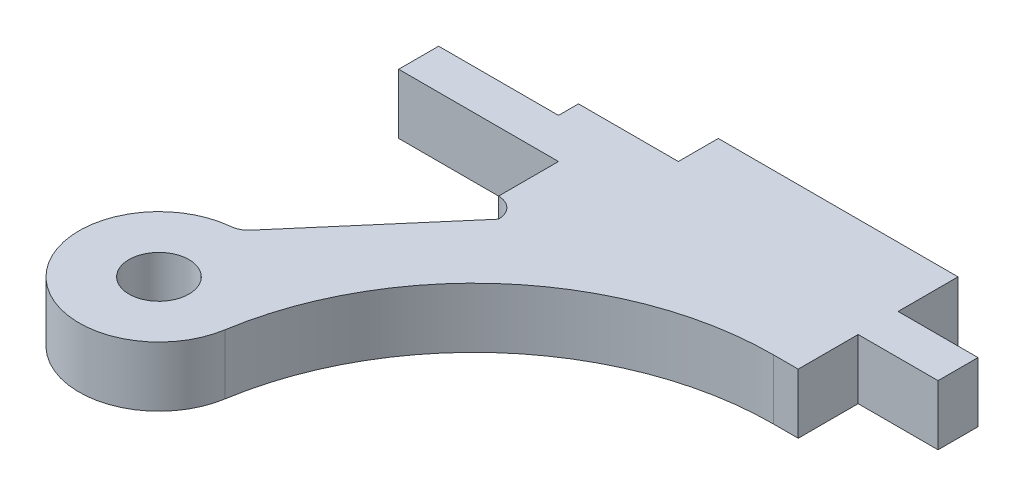
from build123d import *

# Parameters (mm, degrees)
CROQUIS1_R                 = 1.5
SALIENTE_EXTRUIR1_DEPTH    = 3
S_LIDO_MOVER_COPIAR1_ANGLE = 90


with BuildPart() as part:
    # Croquis1 → Saliente-Extruir1 (new body)
    with BuildSketch(Plane.XY):
        with BuildLine():
            Line((41421.305272486, -442.43949549), (41421.305272486, -439.43949549))
            Line((41421.305272486, -439.43949549), (41413.305272486, -439.43949549))
            Line((41413.305272486, -439.43949549), (41413.305272486, -437.43949549))
            Line((41413.305272486, -437.43949549), (41419.305272486, -437.43949549))
            Line((41419.305272486, -437.43949549), (41419.305272486, -436.43949549))
            Line((41419.305272486, -436.43949549), (41424.305272486, -436.43949549))
            Line((41424.305272486, -436.43949549), (41424.305272486, -434.43949549))
            Line((41424.305272486, -434.43949549), (41436.305272486, -434.43949549))
            Line((41436.305272486, -434.43949549), (41436.305272486, -437.43949549))
            Line((41436.305272486, -437.43949549), (41440.305272486, -437.43949549))
            Line((41440.305272486, -437.43949549), (41440.305272486, -439.43949549))
            Line((41440.305272486, -439.43949549), (41436.305272486, -439.43949549))
            Line((41436.305272486, -439.43949549), (41436.305272486, -442.43949549))
            Line((41436.305272486, -442.43949549), (41435.066935525, -442.43949549))
            ThreePointArc((41435.066935525, -442.43949549), (41425.333650257, -446.026206837), (41420.255096284, -455.071074438))
            ThreePointArc((41420.255096284, -455.071074438), (41413.38989409, -457.178212126), (41415.921508638, -450.457947386))
            ThreePointArc((41415.921508638, -450.457947386), (41416.286574465, -450.349956968), (41416.584824278, -450.113351733))
            Line((41416.584824278, -450.113351733), (41422.305272486, -443.43949549))
            ThreePointArc((41422.305272486, -443.43949549), (41422.012379267, -442.732388709), (41421.305272486, -442.43949549))
        make_face()
        with Locations((41416.305272486, -454.43949549)):
            Circle(CROQUIS1_R, mode=Mode.SUBTRACT)
    extrude(amount=SALIENTE_EXTRUIR1_DEPTH)


with BuildPart() as part_1:
    # Sólido-Mover/Copiar1: moved
    add(part.part.rotate(Axis((0, -446.43949549, 1.5), (-1, 0, 0)), S_LIDO_MOVER_COPIAR1_ANGLE))


solid = part_1.part
